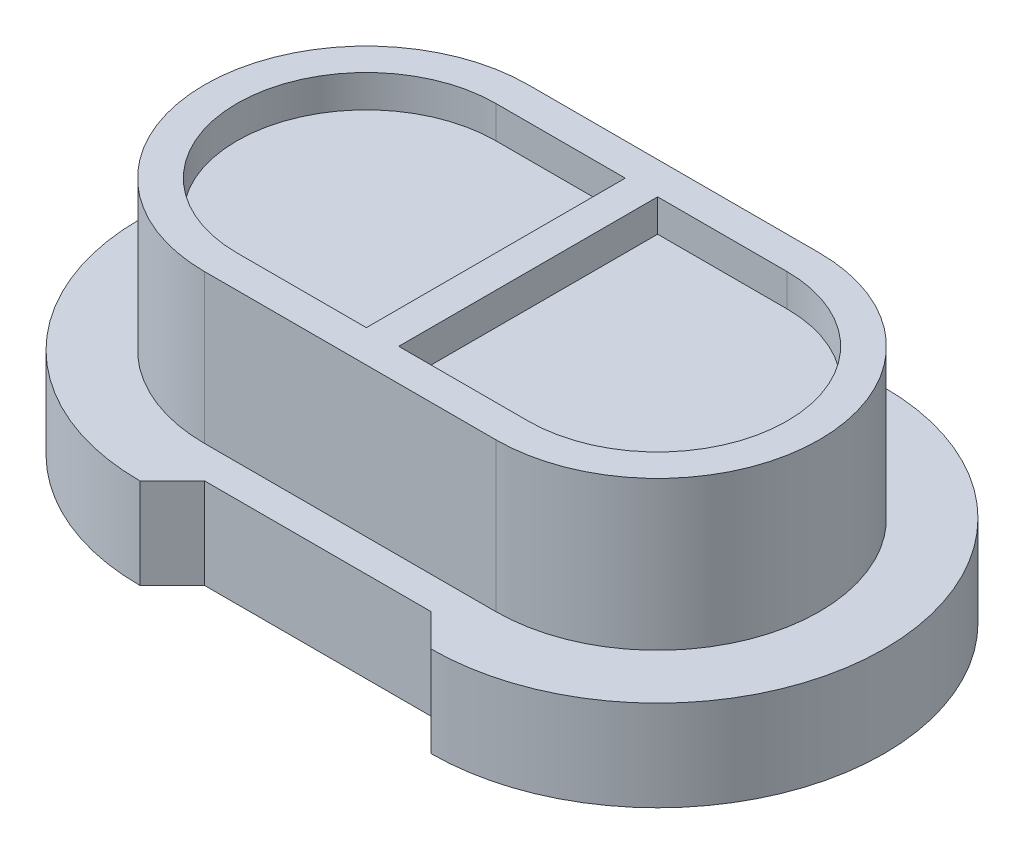
from build123d import *

# Parameters (mm, degrees)
EXTRUDE_1_DEPTH   = 1.4
EXTRUDE_START     = 2.3
EXTRUDE_2_DEPTH   = 2.3
EXTRUDE_3_DEPTH   = 0.2
EXTRUDE_3_2_DEPTH = 0.2
SKETCH_3_W        = 2
SKETCH_3_H        = 2
EXTRUDE_4_DEPTH   = 0.2
EXTRUDE_4_2_DEPTH = 0.2


with BuildPart() as part:
    # Эскиз1 → Бобышка-Вытянуть1 (new body)
    with BuildSketch(Plane(origin=(0, 0, 0), x_dir=(1, 0, 0), z_dir=(0, 1, 0))):
        with BuildLine():
            Line((1.75, -3), (2.25, -3.5))
            ThreePointArc((2.25, -3.5), (5.75, 0), (2.25, 3.5))
            Line((2.25, 3.5), (1.75, 3))
            Line((1.75, 3), (-1.75, 3))
            Line((-1.75, 3), (-2.25, 3.5))
            ThreePointArc((-2.25, 3.5), (-5.75, 0), (-2.25, -3.5))
            Line((-2.25, -3.5), (-1.75, -3))
            Line((-1.75, -3), (1.75, -3))
        make_face()
        with BuildLine():
            Line((2.25, -2), (-2.25, -2))
            ThreePointArc((-2.25, -2), (-4.25, 0), (-2.25, 2))
            Line((-2.25, 2), (2.25, 2))
            ThreePointArc((2.25, 2), (4.25, 0), (2.25, -2))
        make_face(mode=Mode.SUBTRACT)
    extrude(amount=-EXTRUDE_1_DEPTH)

    # Эскиз1<3> → Бобышка-Вытянуть2 (add)
    with BuildSketch(Plane(origin=(0, 0, 0), x_dir=(1, 0, 0), z_dir=(0, 1, 0)).offset(EXTRUDE_START)):
        with BuildLine():
            ThreePointArc((2.25, -2.5), (4.75, 0), (2.25, 2.5))
            Line((2.25, 2.5), (-2.25, 2.5))
            ThreePointArc((-2.25, 2.5), (-4.75, 0), (-2.25, -2.5))
            Line((-2.25, -2.5), (2.25, -2.5))
        make_face()
        with BuildLine():
            Line((2.25, -2), (0.25, -2))
            Line((0.25, -2), (0.25, 2))
            Line((0.25, 2), (2.25, 2))
            ThreePointArc((2.25, 2), (4.25, 0), (2.25, -2))
        make_face(mode=Mode.SUBTRACT)
        with BuildLine():
            Line((-0.25, -2), (-2.25, -2))
            ThreePointArc((-2.25, -2), (-4.25, 0), (-2.25, 2))
            Line((-2.25, 2), (-0.25, 2))
            Line((-0.25, 2), (-0.25, -2))
        make_face(mode=Mode.SUBTRACT)
    extrude(amount=-EXTRUDE_2_DEPTH)


with BuildPart() as body_2:
    # Эскиз2 → Бобышка-Вытянуть3 (new body)
    with BuildSketch(Plane(origin=(0, 1.8, 0), x_dir=(1, 0, 0), z_dir=(0, 1, 0))):
        with BuildLine():
            Line((2.25, 2), (0.25, 2))
            Line((0.25, 2), (0.25, -2))
            Line((0.25, -2), (2.25, -2))
            ThreePointArc((2.25, -2), (4.25, 0), (2.25, 2))
        make_face()
    extrude(amount=-EXTRUDE_3_DEPTH)


with BuildPart() as body_3:
    # Эскиз2 → Extrude 3 2 (new body)
    with BuildSketch(Plane(origin=(0, 1.8, 0), x_dir=(1, 0, 0), z_dir=(0, 1, 0))):
        with BuildLine():
            Line((-0.25, -2), (-2.25, -2))
            ThreePointArc((-2.25, -2), (-4.25, 0), (-2.25, 2))
            Line((-2.25, 2), (-0.25, 2))
            Line((-0.25, 2), (-0.25, -2))
        make_face()
    extrude(amount=-EXTRUDE_3_2_DEPTH)


with BuildPart() as body_4:
    # Эскиз3 → Бобышка-Вытянуть4 (new body)
    with BuildSketch(Plane.XZ.offset(-1.6)):
        with BuildLine():
            Line((2.25, 2), (0.25, 2))
            Line((0.25, 2), (0.25, -2))
            Line((0.25, -2), (2.25, -2))
            ThreePointArc((2.25, -2), (4.25, 0), (2.25, 2))
        make_face()
        with Locations((1.45, 0)):
            Rectangle(SKETCH_3_W, SKETCH_3_H, mode=Mode.SUBTRACT)
    extrude(amount=EXTRUDE_4_DEPTH)


with BuildPart() as body_5:
    # Эскиз3 → Extrude 4 2 (new body)
    with BuildSketch(Plane.XZ.offset(-1.6)):
        with BuildLine():
            Line((-0.25, -2), (-0.25, 2))
            Line((-0.25, 2), (-2.25, 2))
            ThreePointArc((-2.25, 2), (-4.25, 0), (-2.25, -2))
            Line((-2.25, -2), (-0.25, -2))
        make_face()
        with Locations((-1.45, 0)):
            Rectangle(SKETCH_3_W, SKETCH_3_H, mode=Mode.SUBTRACT)
    extrude(amount=EXTRUDE_4_2_DEPTH)


solid = Compound([part.part, body_2.part, body_3.part, body_4.part, body_5.part])
